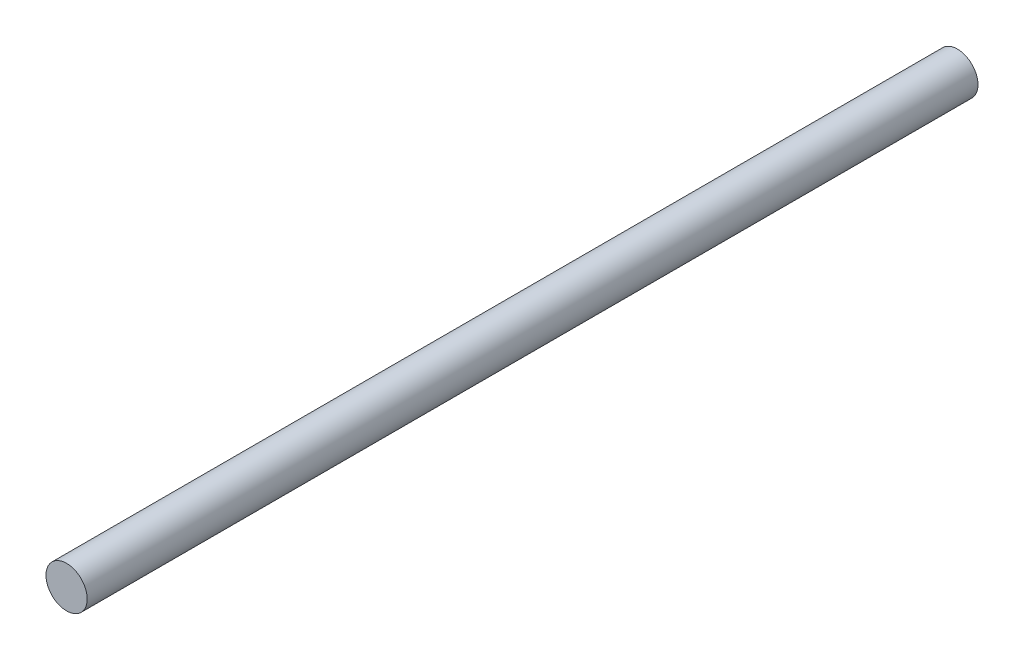
from build123d import *

# Parameters (mm, degrees)
ESBO_O1_R                = 1.25
RESSALTO_EXTRUS_O1_DEPTH = 54


with BuildPart() as part:
    # Esboço1 → Ressalto-extrusão1 (new body)
    with BuildSketch(Plane.XY):
        with Locations((-1.422136389, 0.651812512)):
            Circle(ESBO_O1_R)
    extrude(amount=RESSALTO_EXTRUS_O1_DEPTH)


solid = part.part
